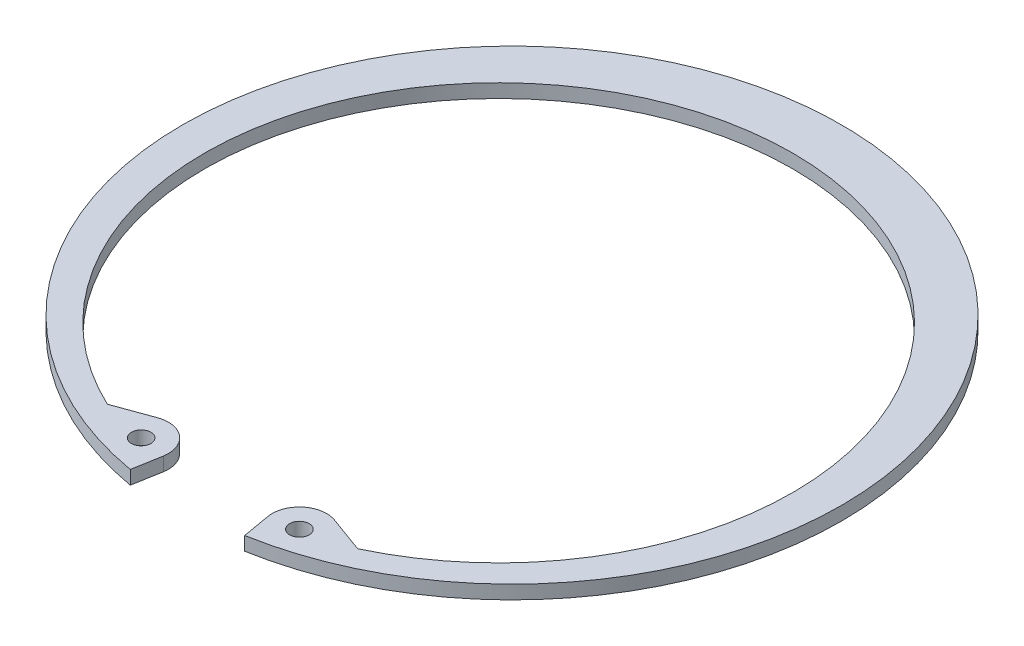
from build123d import *

# Parameters (mm, degrees)
SKETCH2_R      = 1.9812
EXTRUDE1_DEPTH = 2.7686
FILLET1_R      = 0.254


with BuildPart() as part:
    # Sketch2 → Extrude1 (new body)
    with BuildSketch(Plane(origin=(0, 0, 0), x_dir=(1, 0, 0), z_dir=(0, 1, 0))):
        with BuildLine():
            Line((11.600045565, -65.787127517), (10.597394047, -60.100808193))
            ThreePointArc((10.597394047, -60.100808193), (12.486884329, -54.909476309), (17.92745476, -53.950156952))
            Line((17.92745476, -53.950156952), (25.367246838, -56.658019817))
            ThreePointArc((25.367246838, -56.658019817), (0, 56.896), (-25.367246838, -56.658019817))
            Line((-25.367246838, -56.658019817), (-17.92745476, -53.950156952))
            ThreePointArc((-17.92745476, -53.950156952), (-12.486884329, -54.909476309), (-10.597394047, -60.100808193))
            Line((-10.597394047, -60.100808193), (-11.600045565, -65.787127517))
            ThreePointArc((-11.600045565, -65.787127517), (0, 66.802), (11.600045565, -65.787127517))
        make_face()
        with Locations(Location((16.037964478, -59.141488835, 0), (0, 0, 270))):
            Circle(SKETCH2_R, mode=Mode.SUBTRACT)
        with Locations(Location((-16.037964478, -59.141488835, 0), (0, 0, 270))):
            Circle(SKETCH2_R, mode=Mode.SUBTRACT)
    extrude(amount=-EXTRUDE1_DEPTH)

    # Fillet1
    fillet1_edges = [part.edges().sort_by_distance(p)[0] for p in [
        (25.367246838, -1.3843, 56.658019817),
        (-25.367246838, -1.3843, 56.658019817),
    ]]
    fillet(fillet1_edges, radius=FILLET1_R)


solid = part.part
